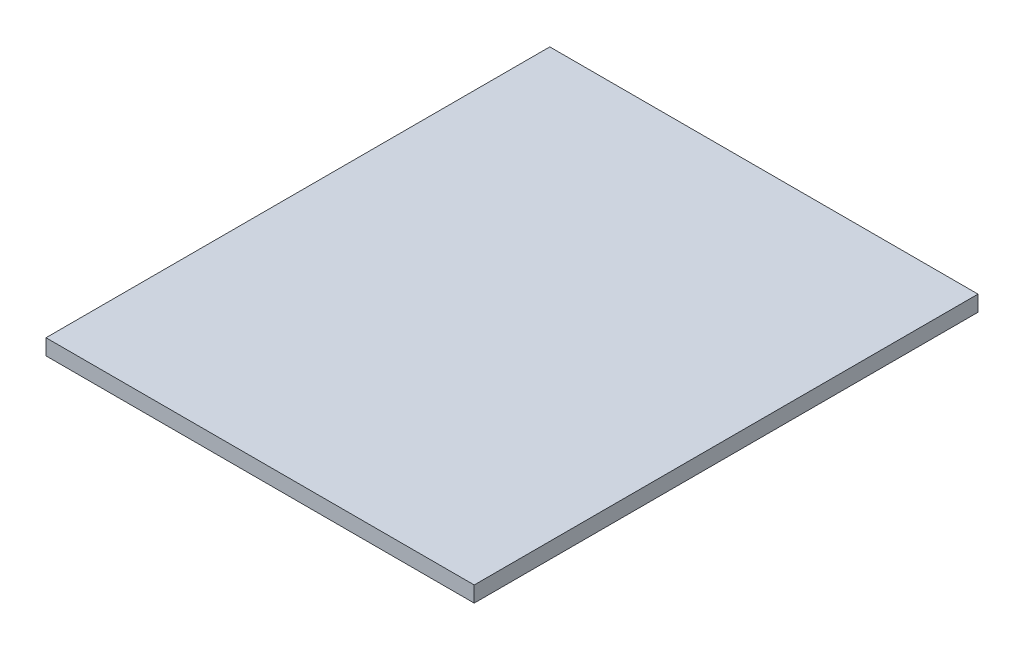
from build123d import *

# Parameters (mm, degrees)
SKETCH1_W           = 86.36
SKETCH1_H           = 101.6
BOSS_EXTRUDE1_DEPTH = 3.175


with BuildPart() as part:
    # Sketch1 → Boss-Extrude1 (new body)
    with BuildSketch(Plane(origin=(0, 0, 0), x_dir=(1, 0, 0), z_dir=(0, 1, 0))):
        Rectangle(SKETCH1_W, SKETCH1_H)
    extrude(amount=BOSS_EXTRUDE1_DEPTH)


solid = part.part
